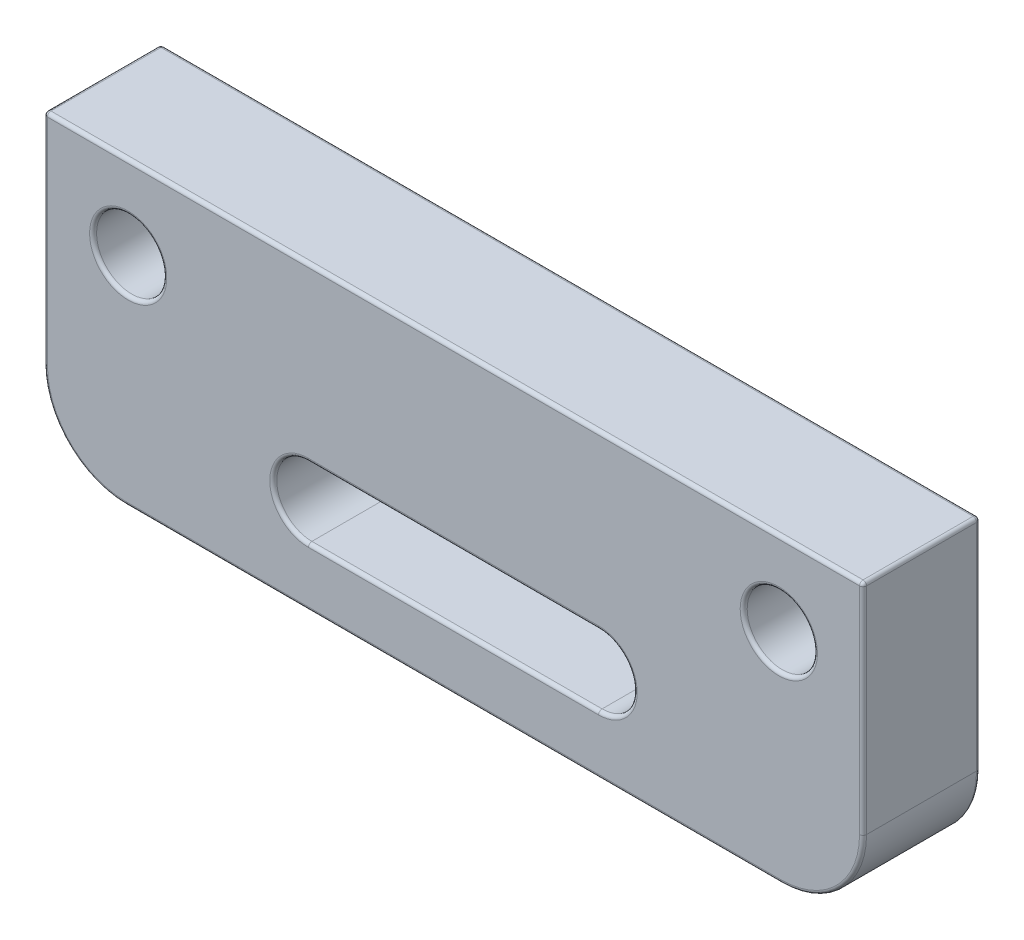
from build123d import *

# Parameters (mm, degrees)
SKETCH1_R               = 1
SKETCH1_R_2             = 1.5
SKETCH1_R_3             = 2
SKETCH1_W               = 22.6
SKETCH1_H               = 12.6
BOSS_EXTRUDE1_DEPTH     = 5
FILLET1_R               = 3.5
FILLET2_R               = 0.15
CUT_EXTRUDE1_DEPTH      = 32.491903803
CUT_EXTRUDE1_DEPTH_BACK = 32.491903803
FILLET3_R               = 0.15


with BuildPart() as part:
    # Sketch1 → Boss-Extrude1 (new body)
    with BuildSketch(Plane.XY):
        with BuildLine():
            Line((-17.5, 8.7), (-17.5, -19.3))
            Line((-17.5, -19.3), (17.5, -19.3))
            Line((17.5, -19.3), (17.5, 8.7))
            ThreePointArc((17.5, 8.7), (0, 25.7), (-17.5, 8.7))
        make_face()
        with Locations((-13.9, 0)):
            Circle(SKETCH1_R, mode=Mode.SUBTRACT)
        with Locations((-13.9, -10)):
            Circle(SKETCH1_R_2, mode=Mode.SUBTRACT)
        with Locations((-8.5, 16.3)):
            Circle(SKETCH1_R_3, mode=Mode.SUBTRACT)
        with Locations(Location((8.5, 16.3, 0), (0, 0, 180))):
            Circle(SKETCH1_R_3, mode=Mode.SUBTRACT)
        with Locations(Location((13.9, 0, 0), (0, 0, 180))):
            Circle(SKETCH1_R, mode=Mode.SUBTRACT)
        with Locations(Location((13.9, -10, 0), (0, 0, 180))):
            Circle(SKETCH1_R_2, mode=Mode.SUBTRACT)
        Rectangle(SKETCH1_W, SKETCH1_H, mode=Mode.SUBTRACT)
        with BuildLine():
            Line((-6.2, -13.8), (6.2, -13.8))
            ThreePointArc((6.2, -13.8), (7.7, -15.3), (6.2, -16.8))
            Line((6.2, -16.8), (-6.2, -16.8))
            ThreePointArc((-6.2, -16.8), (-7.7, -15.3), (-6.2, -13.8))
        make_face(mode=Mode.SUBTRACT)
    extrude(amount=BOSS_EXTRUDE1_DEPTH)

    # Fillet1
    fillet1_edges = [part.edges().sort_by_distance(p)[0] for p in [
        (17.5, -19.3, 2.5),
        (-17.5, -19.3, 2.5),
    ]]
    fillet(fillet1_edges, radius=FILLET1_R)

    # Fillet2
    fillet2_edges = [part.edges().sort_by_distance(p)[0] for p in [
        (11.3, 0, 0),
        (0, 6.3, 0),
        (-11.3, 0, 0),
        (0, -6.3, 0),
        (11.3, 0, 5),
        (0, 6.3, 5),
        (-11.3, 0, 5),
        (0, -6.3, 5),
        (-14.9, 0, 0),
        (-14.9, 0, 5),
        (-15.4, -10, 0),
        (-15.4, -10, 5),
        (-7.7, -15.3, 0),
        (0, -16.8, 0),
        (7.7, -15.3, 0),
        (0, -13.8, 0),
        (-7.7, -15.3, 5),
        (0, -16.8, 5),
        (7.7, -15.3, 5),
        (0, -13.8, 5),
        (-10.5, 16.3, 0),
        (-10.5, 16.3, 5),
        (10.5, 16.3, 0),
        (0, 25.7, 5),
        (10.5, 16.3, 5),
        (14.9, 0, 0),
        (14.9, 0, 5),
        (15.4, -10, 0),
        (15.4, -10, 5),
        (-17.5, -3.55, 0),
        (0, 25.7, 0),
        (17.5, -3.55, 0),
        (17.5, -3.55, 5),
        (0, -19.3, 0),
        (-16.474873734, -18.274873734, 0),
        (16.474873734, -18.274873734, 0),
        (0, -19.3, 5),
        (-16.474873734, -18.274873734, 5),
        (16.474873734, -18.274873734, 5),
        (-17.5, -3.55, 5),
    ]]
    fillet(fillet2_edges, radius=FILLET2_R)

    # Sketch2 → Cut-Extrude1 (cut, two sides: drawn at the far end of the back side and taken through both)
    with BuildSketch(Plane.XY.offset(5).offset(-CUT_EXTRUDE1_DEPTH_BACK)):
        Polygon((-143.203867888, -6.45), (-22.35, -6.45), (27.65, -6.45), (148.503867888, -6.45), (148.503867888, 235.257735776), (-143.203867888, 235.257735776), align=None)
    extrude(amount=CUT_EXTRUDE1_DEPTH + CUT_EXTRUDE1_DEPTH_BACK, mode=Mode.SUBTRACT)

    # Fillet3
    fillet3_edges = [part.edges().sort_by_distance(p)[0] for p in [
        (0, -6.45, 5),
        (17.5, -6.45, 2.5),
        (-17.5, -6.45, 2.5),
        (-17.456066017, -6.45, 4.956066017),
        (-17.456066017, -6.45, 0.043933983),
        (17.456066017, -6.45, 0.043933983),
        (17.456066017, -6.45, 4.956066017),
        (0, -6.45, 0),
    ]]
    fillet(fillet3_edges, radius=FILLET3_R)


solid = part.part
